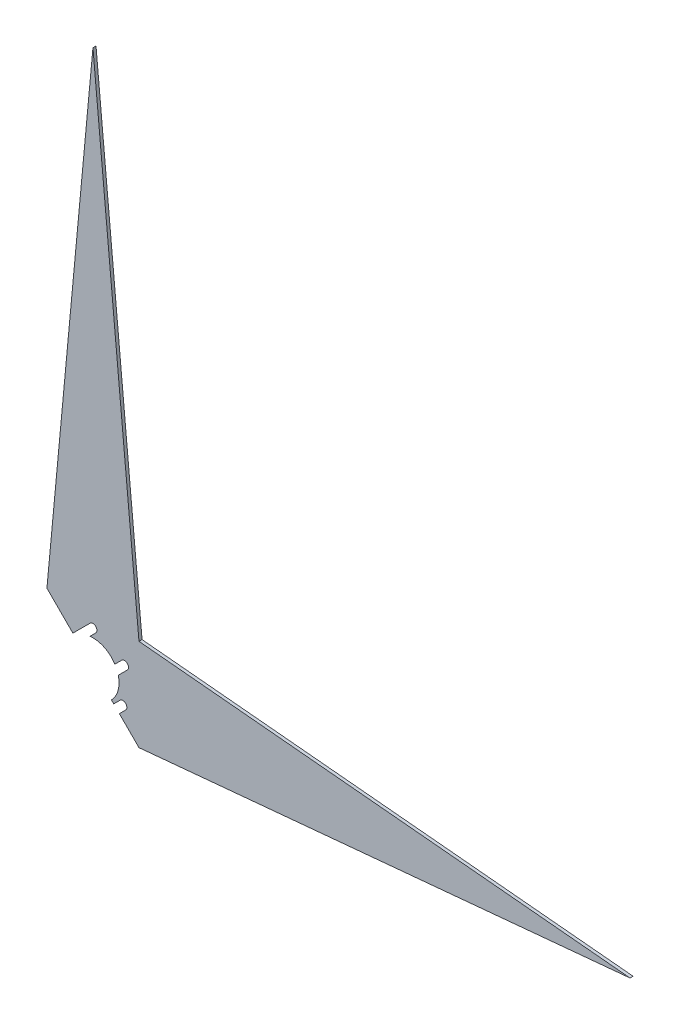
from build123d import *

# Parameters (mm, degrees)
SKETCH_1_R          = 2.6
SKETCH_1_R_2        = 17
EXTRUDE_1_DEPTH     = 2
CUT_EXTRUDE_2_DEPTH = 2


with BuildPart() as part:
    # 草图1 → 凸台-拉伸1 (new body)
    with BuildSketch(Plane.XY):
        Polygon((53.57, -53.57), (373.57, -23.57), (53.57, 6.43), (23.57, 326.43), (-6.43, 6.43), (-6.43, -53.57), align=None)
        with Locations((23.57, -47.32)):
            Circle(SKETCH_1_R, mode=Mode.SUBTRACT)
        with Locations((3.00189666, -11.695)):
            Circle(SKETCH_1_R, mode=Mode.SUBTRACT)
        with Locations((44.13810334, -11.695)):
            Circle(SKETCH_1_R, mode=Mode.SUBTRACT)
        with Locations((43.055571585, -34.82)):
            Circle(SKETCH_1_R, mode=Mode.SUBTRACT)
        with Locations((4.084428415, -34.82)):
            Circle(SKETCH_1_R, mode=Mode.SUBTRACT)
        with Locations((23.57, -1.07)):
            Circle(SKETCH_1_R, mode=Mode.SUBTRACT)
        with Locations((23.57, -23.57)):
            Circle(SKETCH_1_R_2, mode=Mode.SUBTRACT)
    extrude(amount=EXTRUDE_1_DEPTH)

    # 草图2 → 切除-拉伸2 (cut)
    with BuildSketch(Plane.XY.offset(2)):
        Polygon((53.57, -53.57), (-6.43, -53.57), (-6.43, 6.43), (10.481522369, -10.481522369), (21.731522369, 0.768477631), (25.408477631, -2.908477631), (14.158477631, -14.158477631), (26.078074039, -26.078074039), (42.299625709, -9.856522369), (45.976580971, -13.533477631), (29.755029301, -29.755029301), (37.099308161, -37.099308161), (41.217093954, -32.981522369), (44.894049216, -36.658477631), (40.776263424, -40.776263424), align=None)
    extrude(amount=-CUT_EXTRUDE_2_DEPTH, mode=Mode.SUBTRACT)


solid = part.part
